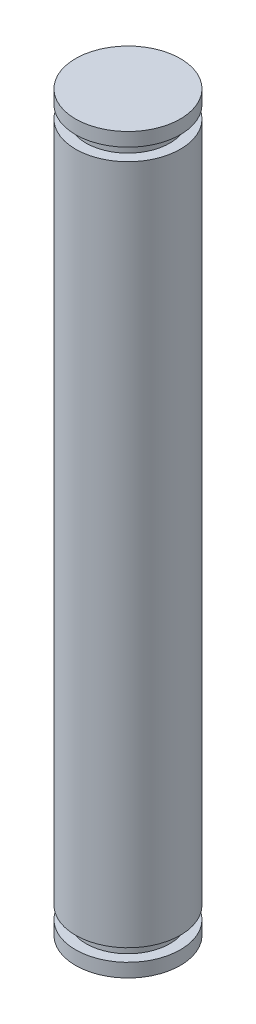
from build123d import *


with BuildPart() as part:
    # 草图1 → 旋转1 (revolve)
    with BuildSketch(Plane.XY, mode=Mode.PRIVATE) as revolve_1_sk:
        Polygon((0, 0), (-5, 0), (-5, 1.3), (-4, 1.3), (-4, 2.5), (-5, 2.5), (-5, 67.5), (-4, 67.5), (-4, 68.7), (-5, 68.7), (-5, 70), (0, 70), align=None)
    revolve(revolve_1_sk.sketch.rotate(Axis((0, 70, 0), (0, -1, 0)), 270), axis=Axis((0, 70, 0), (0, -1, 0)))


solid = part.part
